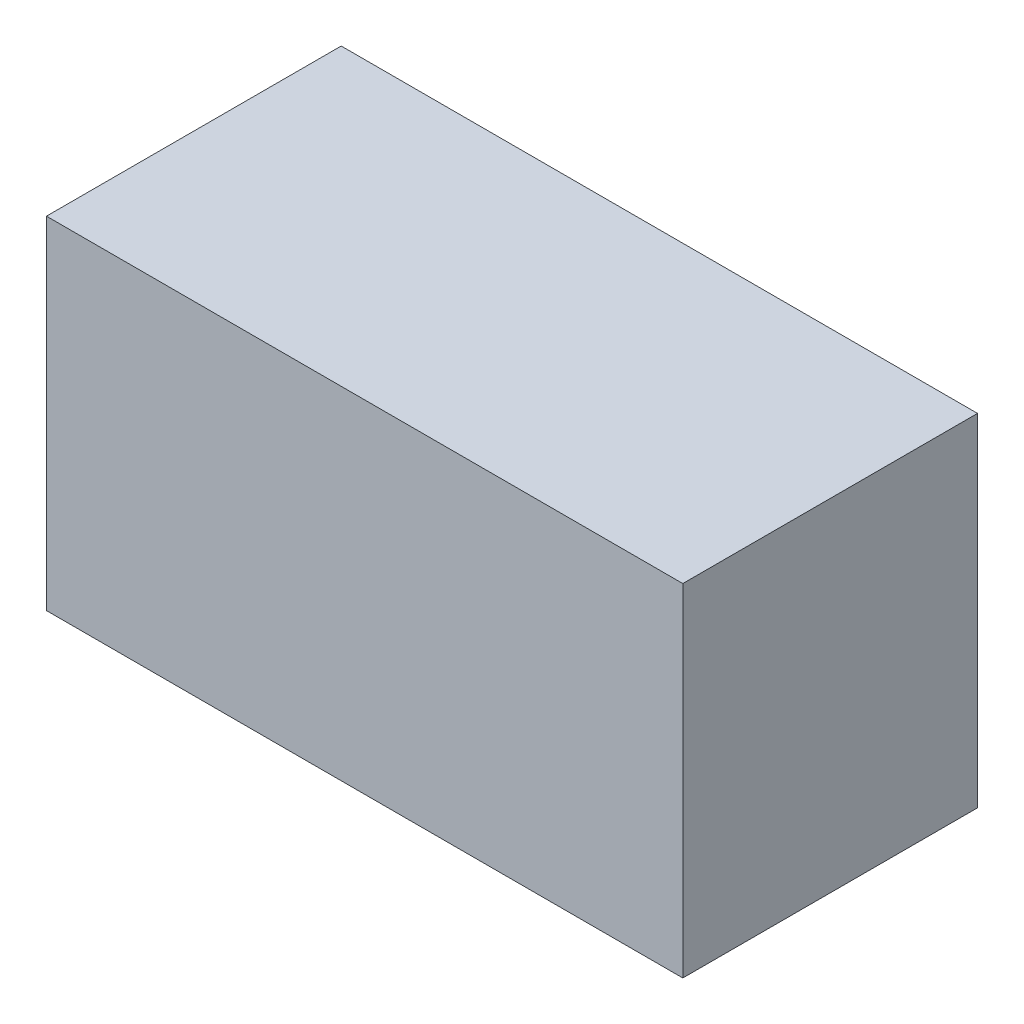
from build123d import *

# Parameters (mm, degrees)
SKETCH1_W           = 95
SKETCH1_H           = 44
BOSS_EXTRUDE1_DEPTH = 51


with BuildPart() as part:
    # Sketch1 → Boss-Extrude1 (new body)
    with BuildSketch(Plane(origin=(0, 0, 0), x_dir=(1, 0, 0), z_dir=(0, 1, 0))):
        Rectangle(SKETCH1_W, SKETCH1_H)
    extrude(amount=BOSS_EXTRUDE1_DEPTH)


solid = part.part
